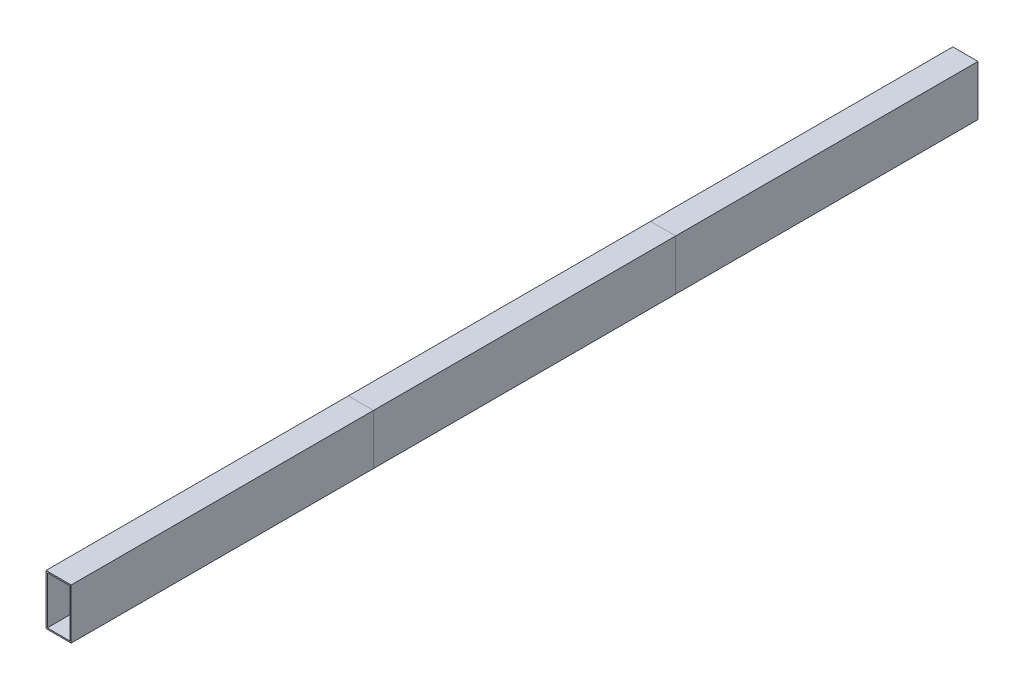
from build123d import *

# Parameters (mm, degrees)
SKETCH_1_W      = 100
SKETCH_1_H      = 200
SKETCH_1_W_2    = 90
SKETCH_1_H_2    = 190
EXTRUDE_1_DEPTH = 1200
EXTRUDE_START   = 1200
SKETCH_1_2_W    = 100
SKETCH_1_2_H    = 200
SKETCH_1_2_W_2  = 90
SKETCH_1_2_H_2  = 190
EXTRUDE_2_DEPTH = 1200
EXTRUDE_START_2 = 2400
SKETCH_1_3_W    = 100
SKETCH_1_3_H    = 200
SKETCH_1_3_W_2  = 90
SKETCH_1_3_H_2  = 190
EXTRUDE_3_DEPTH = 1200


with BuildPart() as part:
    # Эскиз1 → Бобышка-Вытянуть1 (new body)
    with BuildSketch(Plane.XY):
        Rectangle(SKETCH_1_W, SKETCH_1_H)
        Rectangle(SKETCH_1_W_2, SKETCH_1_H_2, mode=Mode.SUBTRACT)
    extrude(amount=EXTRUDE_1_DEPTH)


with BuildPart() as body_2:
    # Эскиз1<2> → Бобышка-Вытянуть2 (new body)
    with BuildSketch(Plane.XY.offset(EXTRUDE_START)):
        Rectangle(SKETCH_1_2_W, SKETCH_1_2_H)
        Rectangle(SKETCH_1_2_W_2, SKETCH_1_2_H_2, mode=Mode.SUBTRACT)
    extrude(amount=EXTRUDE_2_DEPTH)


with BuildPart() as body_3:
    # Эскиз1<3> → Бобышка-Вытянуть3 (new body)
    with BuildSketch(Plane.XY.offset(EXTRUDE_START_2)):
        Rectangle(SKETCH_1_3_W, SKETCH_1_3_H)
        Rectangle(SKETCH_1_3_W_2, SKETCH_1_3_H_2, mode=Mode.SUBTRACT)
    extrude(amount=EXTRUDE_3_DEPTH)


solid = Compound([part.part, body_2.part, body_3.part])
